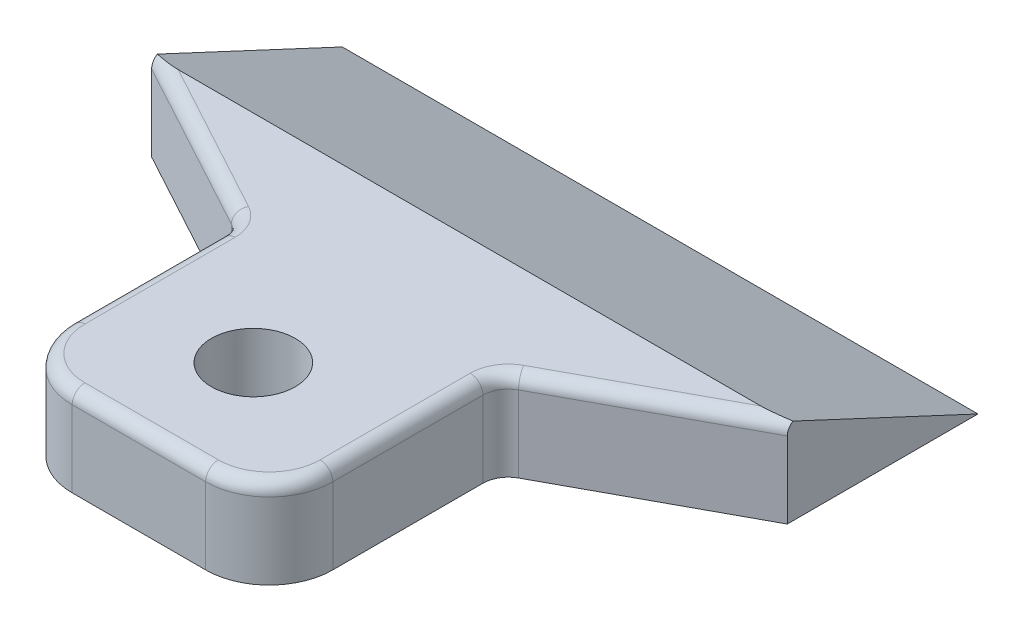
from build123d import *

# Parameters (mm, degrees)
SKETCH1_R           = 3.3
BOSS_EXTRUDE1_DEPTH = 7
CUT_EXTRUDE1_DEPTH  = 66.038450166
SKETCH4_R           = 7
CUT_EXTRUDE2_DEPTH  = 2
FILLET1_R           = 2
FILLET2_R           = 1


with BuildPart() as part:
    # Sketch1 → Boss-Extrude1 (new body)
    with BuildSketch(Plane(origin=(0, 0, 0), x_dir=(1, 0, 0), z_dir=(0, 1, 0))):
        with BuildLine():
            Line((10.25, 18), (25, 26))
            Line((25, 26), (25, 41))
            Line((25, 41), (-25, 41))
            Line((-25, 41), (-25, 26))
            Line((-25, 26), (-10.25, 18))
            Line((-10.25, 18), (-10.25, 5))
            ThreePointArc((-10.25, 5), (-8.785533906, 1.464466094), (-5.25, 0))
            Line((-5.25, 0), (0, 0))
            Line((0, 0), (5.25, 0))
            ThreePointArc((5.25, 0), (8.785533906, 1.464466094), (10.25, 5))
            Line((10.25, 5), (10.25, 18))
        make_face()
        with Locations(Location((0, 9, 0), (0, 0, 270))):
            Circle(SKETCH1_R, mode=Mode.SUBTRACT)
    extrude(amount=BOSS_EXTRUDE1_DEPTH)

    # Sketch2 → Cut-Extrude1 (cut, through all)
    with BuildSketch(Plane(origin=(25, 0, 0), x_dir=(0, 0, -1), z_dir=(1, 0, 0))):
        Polygon((26, 7), (41, 0), (41, 7), align=None)
    extrude(amount=-CUT_EXTRUDE1_DEPTH, mode=Mode.SUBTRACT)

    # Sketch4 → Cut-Extrude2 (cut)
    with BuildSketch(Plane.XZ):
        with Locations(Location((0, -9, 0), (0, 0, 270))):
            Circle(SKETCH4_R)
    extrude(amount=-CUT_EXTRUDE2_DEPTH, mode=Mode.SUBTRACT)

    # Fillet1
    fillet1_edges = [part.edges().sort_by_distance(p)[0] for p in [
        (-10.25, 3.5, -18),
        (10.25, 3.5, -18),
    ]]
    fillet(fillet1_edges, radius=FILLET1_R)

    # Fillet2
    fillet2_edges = [part.edges().sort_by_distance(p)[0] for p in [
        (10.25, 7, -10.904757682),
        (-18.14823696, 7, -22.283789537),
        (-8.785533906, 7, -1.464466094),
        (0, 7, 0),
        (18.14823696, 7, -22.283789537),
        (-10.25, 7, -10.904757682),
        (10.531417421, 7, -17.832488442),
        (-10.531417421, 7, -17.832488442),
        (8.785533906, 7, -1.464466094),
    ]]
    fillet(fillet2_edges, radius=FILLET2_R)


solid = part.part
